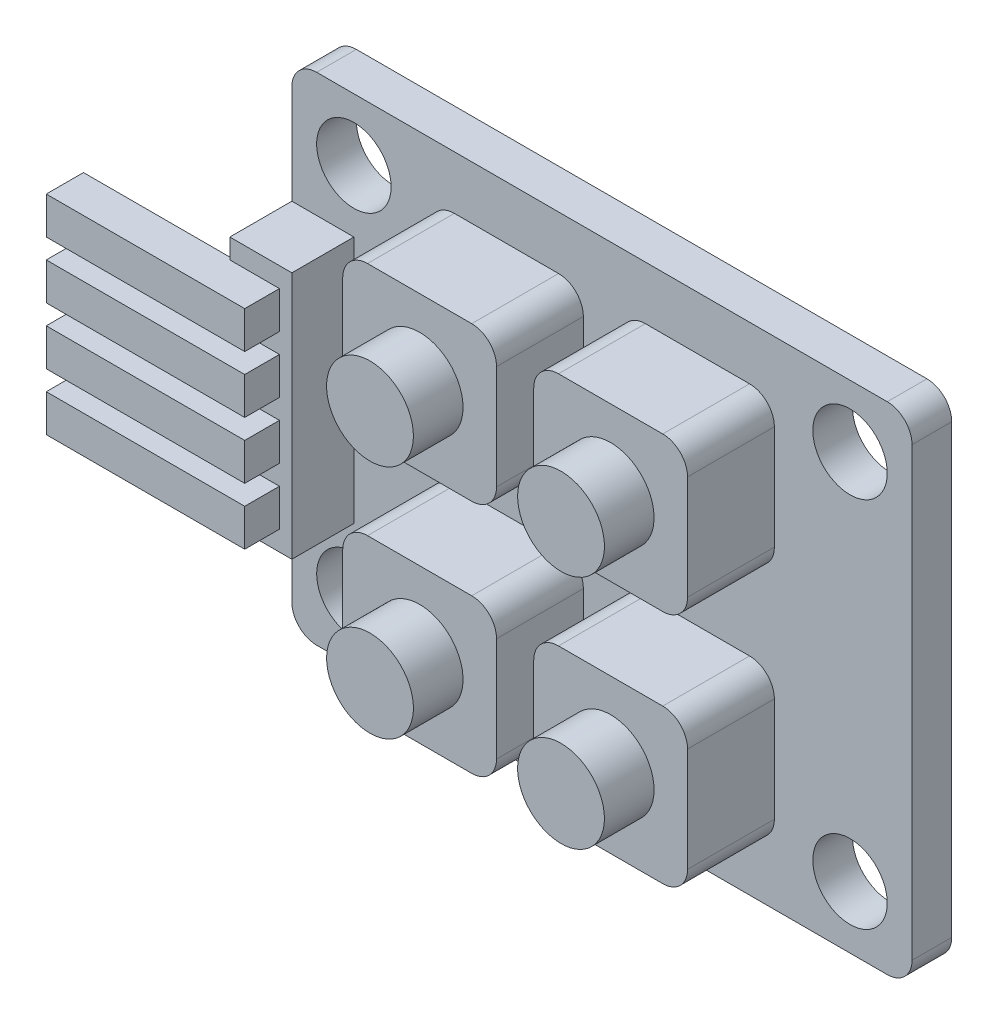
from build123d import *

# Parameters (mm, degrees)
SKETCH1_W           = 25
SKETCH1_H           = 20
BOSS_EXTRUDE1_DEPTH = 1.6
SKETCH2_W           = 6.2
SKETCH2_H           = 6.2
BOSS_EXTRUDE2_DEPTH = 3.5
SKETCH3_R           = 1.75
BOSS_EXTRUDE3_DEPTH = 2
SKETCH4_R           = 1.5
CUT_EXTRUDE1_DEPTH  = 17.92631088
SKETCH5_W           = 2.5
SKETCH5_H           = 10
BOSS_EXTRUDE4_DEPTH = 2.5
SKETCH6_W           = 1.5
SKETCH6_H           = 1.5
BOSS_EXTRUDE5_DEPTH = 1.4
SKETCH7_W           = 1.5
SKETCH7_H           = 1.5
BOSS_EXTRUDE6_DEPTH = 6.5
FILLET1_R           = 1


with BuildPart() as part:
    # Sketch1 → Boss-Extrude1 (new body)
    with BuildSketch(Plane.XY):
        Rectangle(SKETCH1_W, SKETCH1_H)
    extrude(amount=BOSS_EXTRUDE1_DEPTH)

    # Sketch2 → Boss-Extrude2 (add)
    with BuildSketch(Plane.XY.offset(1.6)):
        with Locations((3.85, 4.75)):
            Rectangle(SKETCH2_W, SKETCH2_H)
        with Locations((-3.85, 4.75)):
            Rectangle(SKETCH2_W, SKETCH2_H)
        with Locations((3.85, -4.75)):
            Rectangle(SKETCH2_W, SKETCH2_H)
        with Locations((-3.85, -4.75)):
            Rectangle(SKETCH2_W, SKETCH2_H)
    extrude(amount=BOSS_EXTRUDE2_DEPTH)

    # Sketch3 → Boss-Extrude3 (add)
    with BuildSketch(Plane.XY.offset(5.1)):
        with Locations((-3.85, 4.75)):
            Circle(SKETCH3_R)
        with Locations(Location((3.85, 4.75, 0), (0, 0, 180))):
            Circle(SKETCH3_R)
        with Locations((3.85, -4.75)):
            Circle(SKETCH3_R)
        with Locations(Location((-3.85, -4.75, 0), (0, 0, 180))):
            Circle(SKETCH3_R)
    extrude(amount=BOSS_EXTRUDE3_DEPTH)

    # Sketch4 → Cut-Extrude1 (cut, through all)
    with BuildSketch(Plane.XY.offset(1.6)):
        with Locations((-10, 7.5)):
            Circle(SKETCH4_R)
        with Locations(Location((10, 7.5, 0), (0, 0, 180))):
            Circle(SKETCH4_R)
        with Locations((10, -7.5)):
            Circle(SKETCH4_R)
        with Locations(Location((-10, -7.5, 0), (0, 0, 180))):
            Circle(SKETCH4_R)
    extrude(amount=-CUT_EXTRUDE1_DEPTH, mode=Mode.SUBTRACT)

    # Sketch5 → Boss-Extrude4 (add)
    with BuildSketch(Plane.XY.offset(1.6)):
        with Locations((-11.25, 0)):
            Rectangle(SKETCH5_W, SKETCH5_H)
    extrude(amount=BOSS_EXTRUDE4_DEPTH)

    # Sketch6 → Boss-Extrude5 (add)
    with BuildSketch(Plane.XY.offset(4.1)):
        with Locations((-11.25, -3.45)):
            Rectangle(SKETCH6_W, SKETCH6_H)
        with Locations((-11.25, -1.15)):
            Rectangle(SKETCH6_W, SKETCH6_H)
        with Locations((-11.25, 1.15)):
            Rectangle(SKETCH6_W, SKETCH6_H)
        with Locations((-11.25, 3.45)):
            Rectangle(SKETCH6_W, SKETCH6_H)
    extrude(amount=BOSS_EXTRUDE5_DEPTH)

    # Sketch7 → Boss-Extrude6 (add)
    with BuildSketch(Plane.ZY.offset(12)):
        with Locations((4.75, -3.45)):
            Rectangle(SKETCH7_W, SKETCH7_H)
        with Locations((4.75, -1.15)):
            Rectangle(SKETCH7_W, SKETCH7_H)
        with Locations((4.75, 1.15)):
            Rectangle(SKETCH7_W, SKETCH7_H)
        with Locations((4.75, 3.45)):
            Rectangle(SKETCH7_W, SKETCH7_H)
    extrude(amount=BOSS_EXTRUDE6_DEPTH)

    # Fillet1
    fillet1_edges = [part.edges().sort_by_distance(p)[0] for p in [
        (-6.95, -1.65, 3.35),
        (-6.95, -7.85, 3.35),
        (-0.75, -7.85, 3.35),
        (-0.75, -1.65, 3.35),
        (6.95, -1.65, 3.35),
        (0.75, -1.65, 3.35),
        (0.75, -7.85, 3.35),
        (6.95, -7.85, 3.35),
        (6.95, 1.65, 3.35),
        (6.95, 7.85, 3.35),
        (0.75, 7.85, 3.35),
        (0.75, 1.65, 3.35),
        (-0.75, 1.65, 3.35),
        (-0.75, 7.85, 3.35),
        (-6.95, 7.85, 3.35),
        (-6.95, 1.65, 3.35),
        (12.5, -10, 0.8),
        (-12.5, -10, 0.8),
        (-12.5, 10, 0.8),
        (12.5, 10, 0.8),
    ]]
    fillet(fillet1_edges, radius=FILLET1_R)


solid = part.part
